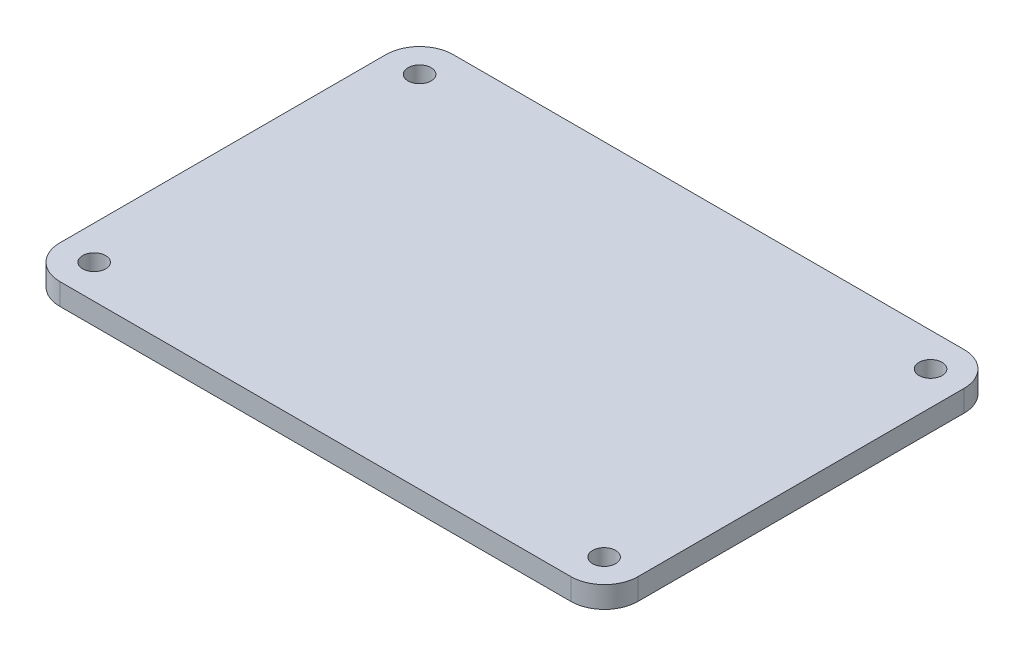
from build123d import *

# Parameters (mm, degrees)
SKETCH2_R           = 1.700388108
SKETCH2_R_2         = 1.700390127
SKETCH2_R_3         = 1.700391472
BOSS_EXTRUDE2_DEPTH = 3.175


with BuildPart() as part:
    # Sketch2 → Boss-Extrude2 (new body)
    with BuildSketch(Plane(origin=(0, 0, 0), x_dir=(1, 0, 0), z_dir=(0, 1, 0))):
        with BuildLine():
            Line((107.487861946, 137.336384548), (32.134526478, 137.336384548))
            add(Edge.make_bspline(
                [(32.134526478, 137.336384548), (29.396970169, 137.336384548), (27.177997625, 139.555359784), (27.177997625, 142.292908018)],
                knots=[1, 1, 1, 1, 2, 2, 2, 2], degree=3))
            Line((27.177997625, 142.292908018), (27.177997625, 190.3800568))
            add(Edge.make_bspline(
                [(27.177997625, 190.3800568), (27.177997625, 193.117610417), (29.396970169, 195.336585653), (32.134526478, 195.336585653)],
                knots=[3, 3, 3, 3, 4, 4, 4, 4], degree=3))
            Line((32.134526478, 195.336585653), (107.487861946, 195.336585653))
            add(Edge.make_bspline(
                [(107.487861946, 195.336585653), (110.225420945, 195.336585653), (112.444385416, 193.1176158), (112.444385416, 190.3800568)],
                knots=[5, 5, 5, 5, 6, 6, 6, 6], degree=3))
            Line((112.444385416, 190.3800568), (112.444385416, 142.292918784))
            add(Edge.make_bspline(
                [(112.444385416, 142.292918784), (112.444385416, 139.555359784), (110.225420945, 137.336384548), (107.487861946, 137.336384548)],
                knots=[7, 7, 7, 7, 8, 8, 8, 8], degree=3))
        make_face()
        with Locations(Location((32.180389311, 190.337721152, 0), (0, 0, 270))):
            Circle(SKETCH2_R, mode=Mode.SUBTRACT)
        with Locations(Location((32.180389311, 142.338781618, 0), (0, 0, 270))):
            Circle(SKETCH2_R_2, mode=Mode.SUBTRACT)
        with Locations(Location((107.445530335, 142.285856339, 0), (0, 0, 270))):
            Circle(SKETCH2_R_3, mode=Mode.SUBTRACT)
        with Locations(Location((107.494913625, 190.38710848, 0), (0, 0, 270))):
            Circle(SKETCH2_R_3, mode=Mode.SUBTRACT)
    extrude(amount=BOSS_EXTRUDE2_DEPTH)


solid = part.part
